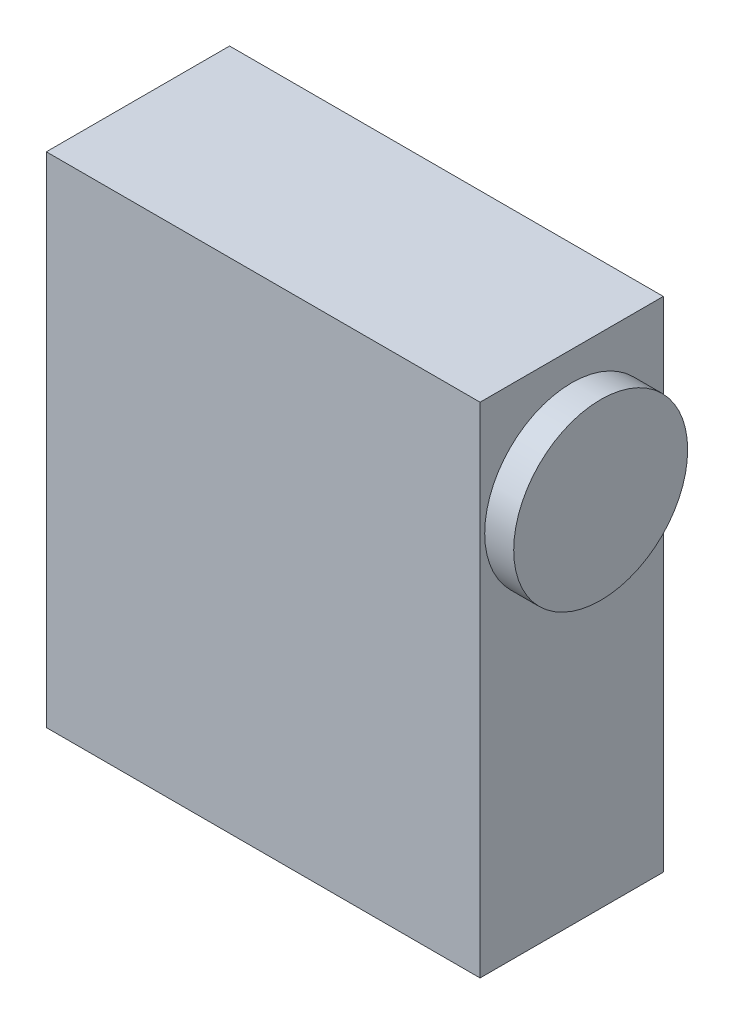
from build123d import *

# Parameters (mm, degrees)
SKETCH1_W           = 47.498
SKETCH1_H           = 20.066
BOSS_EXTRUDE1_DEPTH = 54.61
SKETCH2_R           = 9.525
BOSS_EXTRUDE2_DEPTH = 3.175


with BuildPart() as part:
    # Sketch1 → Boss-Extrude1 (new body)
    with BuildSketch(Plane(origin=(0, 0, 0), x_dir=(1, 0, 0), z_dir=(0, 1, 0))):
        with Locations((23.749, 10.033)):
            Rectangle(SKETCH1_W, SKETCH1_H)
    extrude(amount=BOSS_EXTRUDE1_DEPTH)

    # Sketch2 → Boss-Extrude2 (add)
    with BuildSketch(Plane(origin=(47.498, 0, 0), x_dir=(0, 0, -1), z_dir=(1, 0, 0))):
        with Locations(Location((10.033, 41.91, 0), (0, 0, 180))):
            Circle(SKETCH2_R)
    extrude(amount=BOSS_EXTRUDE2_DEPTH)


solid = part.part
